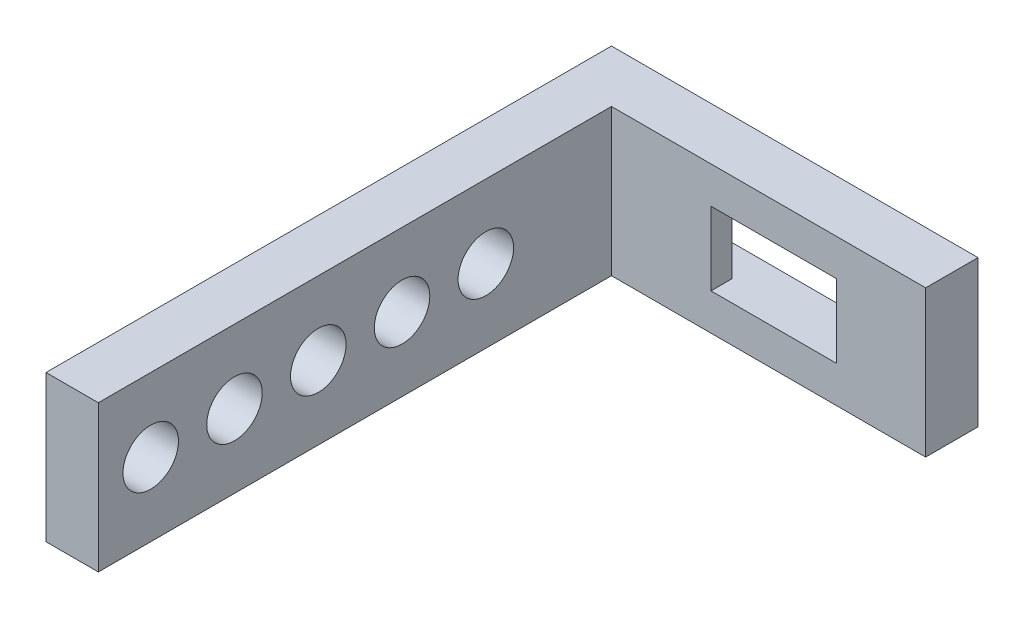
from build123d import *

# Parameters (mm, degrees)
BOSS_EXTRUDE1_DEPTH  = 14
SKETCH20_W           = 45
SKETCH20_H           = 14
BOSS_EXTRUDE10_DEPTH = 5
SKETCH21_R           = 2.65
CUT_EXTRUDE13_DEPTH  = 5
SKETCH22_W           = 5
SKETCH22_H           = 4
CUT_EXTRUDE14_DEPTH  = 62.814237842
SKETCH23_R           = 2.65
BOSS_EXTRUDE11_DEPTH = 5
SKETCH24_W           = 25
SKETCH24_H           = 7
CUT_EXTRUDE15_DEPTH  = 3
CUT_EXTRUDE16_REACH  = 68.31
SKETCH25_W           = 12
SKETCH25_H           = 7
CUT_EXTRUDE17_REACH  = 70.644
SKETCH26_W           = 5
SKETCH26_H           = 14


with BuildPart() as part:
    # Sketch1 → Boss-Extrude1 (new body)
    with BuildSketch(Plane(origin=(0, 0, 0), x_dir=(1, 0, 0), z_dir=(0, 1, 0))):
        Polygon((6.589095597, 0), (10, 0), (10, 4), (40, 4), (40, 9), (11.589095597, 9), (0, 9), (0, 0), align=None)
    extrude(amount=BOSS_EXTRUDE1_DEPTH)

    # Sketch20 → Boss-Extrude10 (add)
    with BuildSketch(Plane.ZY):
        with Locations((22.5, 7)):
            Rectangle(SKETCH20_W, SKETCH20_H)
    extrude(amount=-BOSS_EXTRUDE10_DEPTH)

    # Sketch21 → Cut-Extrude13 (cut)
    with BuildSketch(Plane.ZY):
        with Locations((0, 7)):
            Circle(SKETCH21_R)
        with Locations((8, 7)):
            Circle(SKETCH21_R)
        with Locations((16, 7)):
            Circle(SKETCH21_R)
        with Locations((24, 7)):
            Circle(SKETCH21_R)
        with Locations((32, 7)):
            Circle(SKETCH21_R)
        with Locations((40, 7)):
            Circle(SKETCH21_R)
    extrude(amount=-CUT_EXTRUDE13_DEPTH, mode=Mode.SUBTRACT)

    # Sketch22 → Cut-Extrude14 (cut, through all)
    with BuildSketch(Plane(origin=(0, 14, 0), x_dir=(1, 0, 0), z_dir=(0, 1, 0))):
        with Locations((7.5, 2)):
            Rectangle(SKETCH22_W, SKETCH22_H)
    extrude(amount=-CUT_EXTRUDE14_DEPTH, mode=Mode.SUBTRACT)

    # Sketch23 → Boss-Extrude11 (add)
    with BuildSketch(Plane.ZY):
        with Locations((0, 7)):
            Circle(SKETCH23_R)
    extrude(amount=-BOSS_EXTRUDE11_DEPTH)

    # Sketch24 → Cut-Extrude15 (cut)
    with BuildSketch(Plane(origin=(0, 0, -9), x_dir=(-1, 0, 0), z_dir=(0, 0, -1))):
        with Locations((-20.5, 7)):
            Rectangle(SKETCH24_W, SKETCH24_H)
    extrude(amount=-CUT_EXTRUDE15_DEPTH, mode=Mode.SUBTRACT)

    # Sketch25 → Cut-Extrude16 (cut, up to next)
    with BuildSketch(Plane(origin=(0, 0, -6), x_dir=(-1, 0, 0), z_dir=(0, 0, -1)), mode=Mode.PRIVATE) as cut_extrude16_sk1:
        with Locations((-20.5, 7)):
            Rectangle(SKETCH25_W, SKETCH25_H)
    cut_extrude16_tool1 = extrude(cut_extrude16_sk1.sketch, amount=-CUT_EXTRUDE16_REACH, mode=Mode.PRIVATE) & part.part
    add(cut_extrude16_tool1.solids().sort_by_distance((20.5, 7, -6))[0], mode=Mode.SUBTRACT)

    # Sketch26 → Cut-Extrude17 (cut, up to next)
    with BuildSketch(Plane(origin=(0, 0, -9), x_dir=(-1, 0, 0), z_dir=(0, 0, -1)), mode=Mode.PRIVATE) as cut_extrude17_sk1:
        with Locations((-37.5, 7)):
            Rectangle(SKETCH26_W, SKETCH26_H)
    cut_extrude17_tool1 = extrude(cut_extrude17_sk1.sketch, amount=-CUT_EXTRUDE17_REACH, mode=Mode.PRIVATE) & part.part
    add(cut_extrude17_tool1.solids().sort_by_distance((37.5, 7, -9))[0], mode=Mode.SUBTRACT)


solid = part.part
